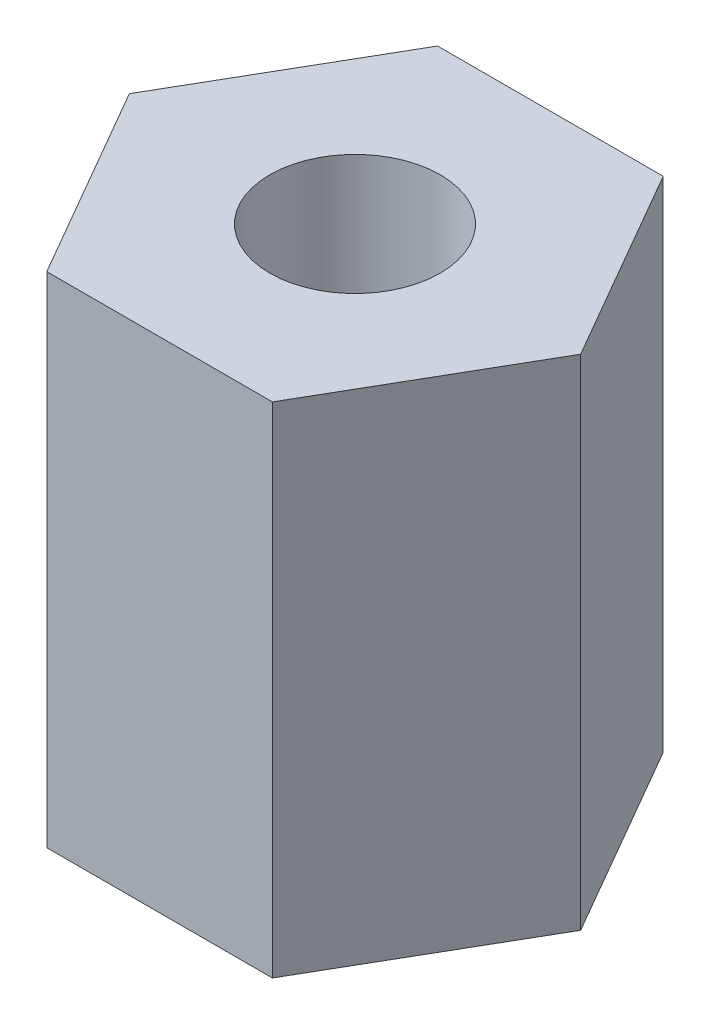
from build123d import *

# Parameters (mm, degrees)
BOSS_EXTRUDE1_DEPTH                = 6
TAP_DRILL_FOR_M2_5X0_45_TAP1_D     = 2.05
TAP_DRILL_FOR_M2_5X0_45_TAP1_DEPTH = 19


with BuildPart() as part:
    # Sketch1 → Boss-Extrude1 (new body)
    with BuildSketch(Plane(origin=(0, 6, 0), x_dir=(1, 0, 0), z_dir=(0, 1, 0))):
        Polygon((1.356773133, -2.35), (2.713546265, 0), (1.356773133, 2.35), (-1.356773133, 2.35), (-2.713546265, 0), (-1.356773133, -2.35), align=None)
    extrude(amount=-BOSS_EXTRUDE1_DEPTH)

    # Tap Drill for M2.5x0.45 Tap1
    with Locations(Plane(origin=(0, 6, 0), x_dir=(1, 0, 0), z_dir=(0, 1, 0))):
        with Locations((0, 0)):
            Hole(TAP_DRILL_FOR_M2_5X0_45_TAP1_D / 2, depth=TAP_DRILL_FOR_M2_5X0_45_TAP1_DEPTH)


solid = part.part
